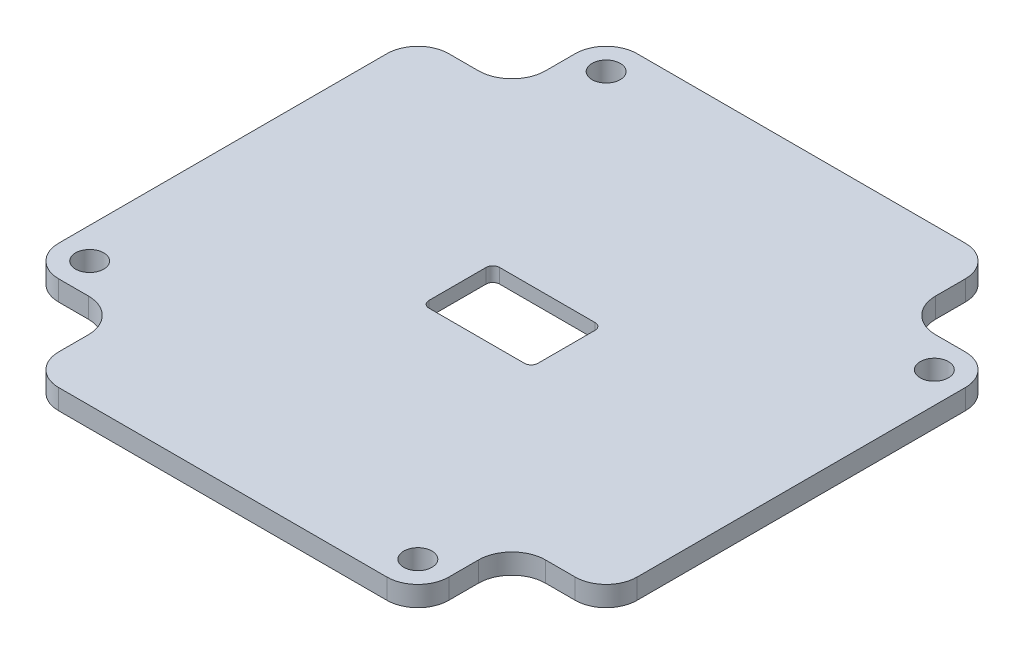
from build123d import *

# Parameters (mm, degrees)
SKETCH1_W           = 86
SKETCH1_H           = 86
BOSS_EXTRUDE1_DEPTH = 3
SKETCH2_W           = 14
SKETCH2_H           = 14
SKETCH2_W_2         = 16.2
SKETCH2_H_2         = 10.5
CUT_EXTRUDE1_DEPTH  = 61.88513776
FILLET1_R           = 4.6
FILLET2_R           = 5
SKETCH3_R           = 2.1
CUT_EXTRUDE2_DEPTH  = 61.88513776
CUT_EXTRUDE3_START  = -3
SKETCH4_W           = 23.5
SKETCH4_H           = 22.8
CUT_EXTRUDE3_DEPTH  = 0.85
FILLET3_R           = 3.4
CUT_EXTRUDE4_START  = -1.5
SKETCH5_W           = 23.5
SKETCH5_H           = 14
SKETCH5_H_2         = 7.6
SKETCH5_W_2         = 14
SKETCH5_H_3         = 22.8
SKETCH5_W_3         = 7.25
CUT_EXTRUDE4_DEPTH  = 60.38513776
FILLET4_R           = 3
FILLET5_R           = 1


with BuildPart() as part:
    # Sketch1 → Boss-Extrude1 (new body)
    with BuildSketch(Plane(origin=(0, 0, 0), x_dir=(1, 0, 0), z_dir=(0, 1, 0))):
        Rectangle(SKETCH1_W, SKETCH1_H)
    extrude(amount=BOSS_EXTRUDE1_DEPTH)

    # Sketch2 → Cut-Extrude1 (cut, through all)
    with BuildSketch(Plane(origin=(0, 3, 0), x_dir=(1, 0, 0), z_dir=(0, 1, 0))):
        with Locations((36, 36)):
            Rectangle(SKETCH2_W, SKETCH2_H)
        with Locations((-36, 36)):
            Rectangle(SKETCH2_W, SKETCH2_H)
        with Locations((36, -36)):
            Rectangle(SKETCH2_W, SKETCH2_H)
        with Locations((-36, -36)):
            Rectangle(SKETCH2_W, SKETCH2_H)
        Rectangle(SKETCH2_W_2, SKETCH2_H_2)
    extrude(amount=-CUT_EXTRUDE1_DEPTH, mode=Mode.SUBTRACT)

    # Fillet1
    fillet1_edges = [part.edges().sort_by_distance(p)[0] for p in [
        (-43, 1.5, 29),
        (-29, 1.5, 43),
        (43, 1.5, 29),
        (29, 1.5, 43),
        (29, 1.5, -43),
        (43, 1.5, -29),
        (-43, 1.5, -29),
        (-29, 1.5, -43),
    ]]
    fillet(fillet1_edges, radius=FILLET1_R)

    # Fillet2
    fillet2_edges = [part.edges().sort_by_distance(p)[0] for p in [
        (-29, 1.5, 29),
        (29, 1.5, 29),
        (29, 1.5, -29),
        (-29, 1.5, -29),
    ]]
    fillet(fillet2_edges, radius=FILLET2_R)

    # Sketch3 → Cut-Extrude2 (cut, through all)
    with BuildSketch(Plane(origin=(0, 3, 0), x_dir=(1, 0, 0), z_dir=(0, 1, 0))):
        with Locations(Location((38.4, 24.4, 0), (0, 0, 270))):
            Circle(SKETCH3_R)
        with Locations(Location((-24.4, 38.4, 0), (0, 0, 270))):
            Circle(SKETCH3_R)
        with Locations(Location((24.4, -38.4, 0), (0, 0, 270))):
            Circle(SKETCH3_R)
        with Locations(Location((-38.4, -24.4, 0), (0, 0, 270))):
            Circle(SKETCH3_R)
    extrude(amount=-CUT_EXTRUDE2_DEPTH, mode=Mode.SUBTRACT)

    # Sketch4 → Cut-Extrude3 (cut)
    with BuildSketch(Plane(origin=(0, 3, 0), x_dir=(1, 0, 0), z_dir=(0, 1, 0)).offset(CUT_EXTRUDE3_START)):
        Rectangle(SKETCH4_W, SKETCH4_H)
    extrude(amount=CUT_EXTRUDE3_DEPTH, mode=Mode.SUBTRACT)

    # Fillet3
    fillet3_edges = [part.edges().sort_by_distance(p)[0] for p in [
        (-11.75, 0.425, 11.4),
        (11.75, 0.425, 11.4),
        (11.75, 0.425, -11.4),
        (-11.75, 0.425, -11.4),
    ]]
    fillet(fillet3_edges, radius=FILLET3_R)

    # Sketch5 → Cut-Extrude4 (cut, through all)
    with BuildSketch(Plane(origin=(0, 3, 0), x_dir=(1, 0, 0), z_dir=(0, 1, 0)).offset(CUT_EXTRUDE4_START)):
        with Locations((0, 31)):
            Rectangle(SKETCH5_W, SKETCH5_H)
        with Locations((0, 20.2)):
            Rectangle(SKETCH5_W, SKETCH5_H_2)
        with Locations((-31, 0)):
            Rectangle(SKETCH5_W_2, SKETCH5_H_3)
        with Locations((-20.375, 0)):
            Rectangle(SKETCH5_W_3, SKETCH5_H_3)
        with Locations((31, 0)):
            Rectangle(SKETCH5_W_2, SKETCH5_H_3)
        with Locations((20.375, 0)):
            Rectangle(SKETCH5_W_3, SKETCH5_H_3)
        with Locations((0, -20.2)):
            Rectangle(SKETCH5_W, SKETCH5_H_2)
        with Locations((0, -31)):
            Rectangle(SKETCH5_W, SKETCH5_H)
        with Locations((20.375, -20.2)):
            Rectangle(SKETCH5_W_3, SKETCH5_H_2)
        Polygon((24, -16.4), (24, -24), (34, -24), (38, -24), (38, -16.4), align=None)
        with BuildLine():
            Line((24, -24), (16.75, -24))
            Line((16.75, -24), (16.75, -38))
            Line((16.75, -38), (17.311276561, -38))
            ThreePointArc((17.311276561, -38), (19.379541854, -33.379541854), (24, -31.311276561))
            Line((24, -31.311276561), (24, -24))
        make_face()
        with BuildLine():
            Line((34, -24), (24, -24))
            Line((24, -24), (24, -31.311276561))
            ThreePointArc((24, -31.311276561), (24.185616902, -31.303237366), (24.371380604, -31.300057681))
            ThreePointArc((24.371380604, -31.300057681), (27.958453145, -26.031329371), (34, -24))
        make_face()
        Polygon((-16.75, -24), (-24, -24), (-24, -34), (-24, -38), (-16.75, -38), align=None)
        with Locations((-20.375, -20.2)):
            Rectangle(SKETCH5_W_3, SKETCH5_H_2)
        with BuildLine():
            Line((-24, -24), (-24, -16.4))
            Line((-24, -16.4), (-38, -16.4))
            Line((-38, -16.4), (-38, -17.311276561))
            ThreePointArc((-38, -17.311276561), (-33.379541854, -19.379541854), (-31.311276561, -24))
            Line((-31.311276561, -24), (-24, -24))
        make_face()
        with BuildLine():
            Line((-24, -34), (-24, -24))
            Line((-24, -24), (-31.311276561, -24))
            ThreePointArc((-31.311276561, -24), (-31.303237366, -24.185616902), (-31.300057681, -24.371380604))
            ThreePointArc((-31.300057681, -24.371380604), (-26.031329371, -27.958453145), (-24, -34))
        make_face()
        Polygon((-38, 16.4), (-24, 16.4), (-24, 24), (-34, 24), (-38, 24), align=None)
        with BuildLine():
            Line((-24, 31.311276561), (-24, 24))
            Line((-24, 24), (-16.75, 24))
            Line((-16.75, 24), (-16.75, 38))
            Line((-16.75, 38), (-17.311276561, 38))
            ThreePointArc((-17.311276561, 38), (-19.379541854, 33.379541854), (-24, 31.311276561))
        make_face()
        with Locations((-20.375, 20.2)):
            Rectangle(SKETCH5_W_3, SKETCH5_H_2)
        with BuildLine():
            Line((-34, 24), (-24, 24))
            Line((-24, 24), (-24, 31.311276561))
            ThreePointArc((-24, 31.311276561), (-24.185616902, 31.303237366), (-24.371380604, 31.300057681))
            ThreePointArc((-24.371380604, 31.300057681), (-27.958453145, 26.031329371), (-34, 24))
        make_face()
        Polygon((16.75, 38), (16.75, 24), (24, 24), (24, 34), (24, 38), align=None)
        with Locations((20.375, 20.2)):
            Rectangle(SKETCH5_W_3, SKETCH5_H_2)
        with BuildLine():
            Line((31.311276561, 24), (24, 24))
            Line((24, 24), (24, 16.4))
            Line((24, 16.4), (38, 16.4))
            Line((38, 16.4), (38, 17.311276561))
            ThreePointArc((38, 17.311276561), (33.379541854, 19.379541854), (31.311276561, 24))
        make_face()
        with BuildLine():
            Line((24, 34), (24, 24))
            Line((24, 24), (31.311276561, 24))
            ThreePointArc((31.311276561, 24), (31.303237366, 24.185616902), (31.300057681, 24.371380604))
            ThreePointArc((31.300057681, 24.371380604), (26.031329371, 27.958453145), (24, 34))
        make_face()
    extrude(amount=-CUT_EXTRUDE4_DEPTH, mode=Mode.SUBTRACT)

    # Fillet4
    fillet4_edges = [part.edges().sort_by_distance(p)[0] for p in [
        (-16.75, 0.75, 11.4),
        (-38, 0.75, 11.4),
        (-38, 0.75, -11.4),
        (-16.75, 0.75, -11.4),
        (16.75, 0.75, -11.4),
        (38, 0.75, -11.4),
        (38, 0.75, 11.4),
        (16.75, 0.75, 11.4),
        (-11.75, 0.75, 38),
        (-11.75, 0.75, 16.4),
        (11.75, 0.75, 16.4),
        (11.75, 0.75, 38),
        (16.75, 0.75, 16.4),
        (38, 0.75, 16.4),
        (-16.75, 0.75, 16.4),
        (-16.75, 0.75, 38),
        (-24, 0.75, 38),
        (-38, 0.75, -24),
        (-16.75, 0.75, -16.4),
        (-38, 0.75, -16.4),
        (16.75, 0.75, -16.4),
        (16.75, 0.75, -38),
        (24, 0.75, -38),
        (-11.75, 0.75, -16.4),
        (-11.75, 0.75, -38),
        (11.75, 0.75, -38),
        (11.75, 0.75, -16.4),
    ]]
    fillet(fillet4_edges, radius=FILLET4_R)

    # Fillet5
    fillet5_edges = [part.edges().sort_by_distance(p)[0] for p in [
        (-8.1, 1.925, -5.25),
        (8.1, 1.925, -5.25),
        (-8.1, 1.925, 5.25),
        (8.1, 1.925, 5.25),
    ]]
    fillet(fillet5_edges, radius=FILLET5_R)


solid = part.part
